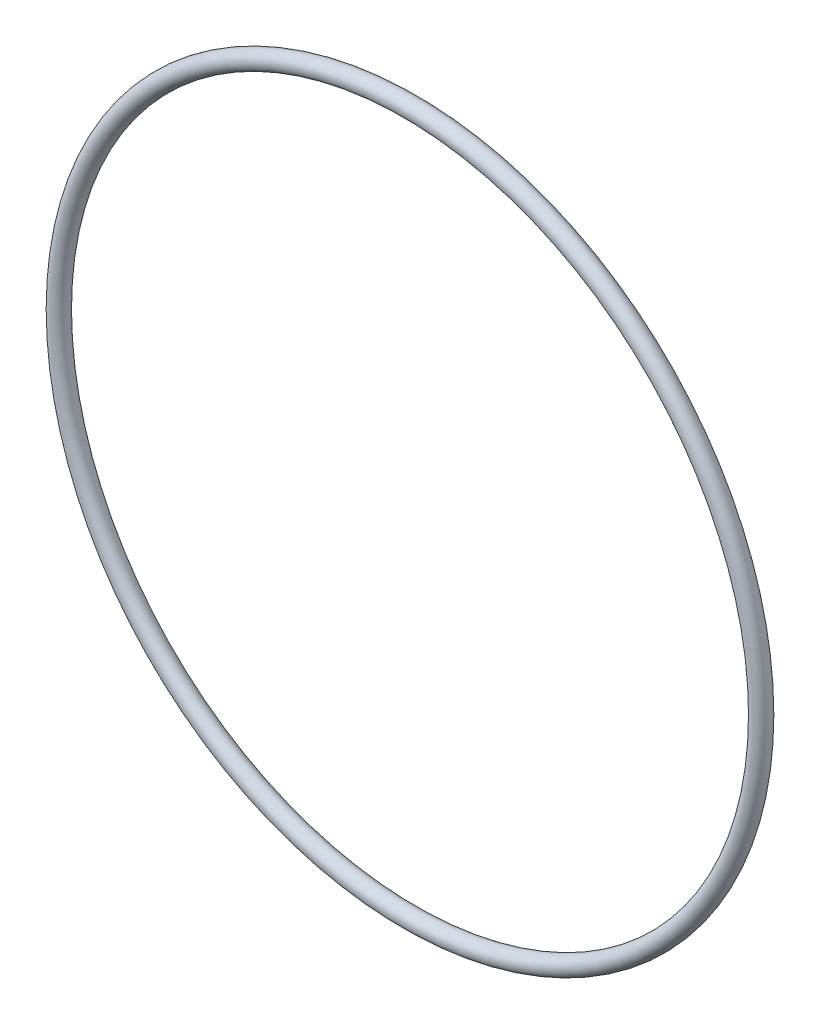
from build123d import *

# Parameters (mm, degrees)
SWEEP1_PROFILE_R = 1.524


with BuildPart() as part:
    # Sweep1: sweep along a path in Sketch1
    with BuildLine(Plane.XY) as sweep1_path:
        CenterArc((0, 0), 59.69, 0, 360)
    # Sweep1 profile (on start of the path) → Sweep1 (sweep)
    with BuildSketch(Plane(origin=(59.69, 0, 0), x_dir=(0, 0, 1), z_dir=(0, 1, 0))):
        Circle(SWEEP1_PROFILE_R)
    sweep(path=sweep1_path.line)


solid = part.part
